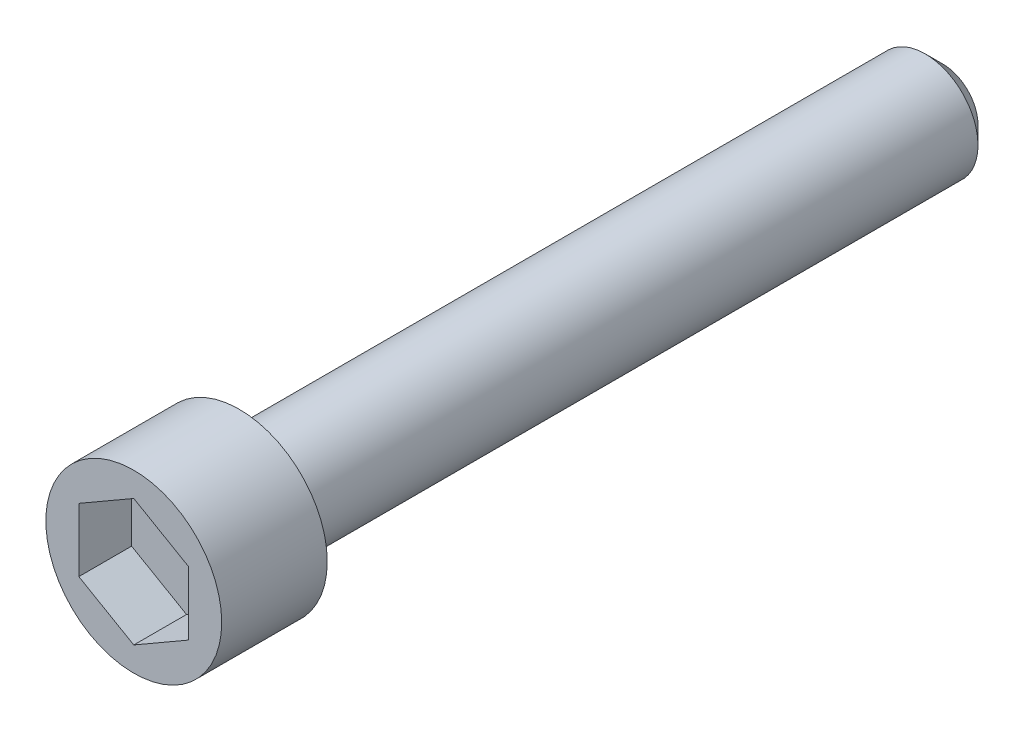
from build123d import *

# Parameters (mm, degrees)
SKETCH_1_R          = 1.5
EXTRUDE_1_DEPTH     = 20
SKETCH_2_R          = 2.5
EXTRUDE_2_DEPTH     = 3
CUT_EXTRUDE_1_DEPTH = 1.5
CHAMFER_1_SIZE      = 0.5


with BuildPart() as part:
    # 草图1 → 凸台-拉伸1 (new body)
    with BuildSketch(Plane.XY):
        Circle(SKETCH_1_R)
    extrude(amount=EXTRUDE_1_DEPTH)

    # 草图2 → 凸台-拉伸2 (add)
    with BuildSketch(Plane.XY.offset(20)):
        Circle(SKETCH_2_R)
    extrude(amount=EXTRUDE_2_DEPTH)

    # 草图3 → 切除-拉伸1 (cut)
    with BuildSketch(Plane.XY.offset(23)):
        Polygon((0, 1.803382283), (-1.56177487, 0.901691141), (-1.56177487, -0.901691141), (0, -1.803382283), (1.56177487, -0.901691141), (1.56177487, 0.901691141), align=None)
    extrude(amount=-CUT_EXTRUDE_1_DEPTH, mode=Mode.SUBTRACT)

    # 倒角1
    chamfer_1_edges = [part.edges().sort_by_distance(p)[0] for p in [
        (-1.5, 0, 0),
    ]]
    chamfer(chamfer_1_edges, length=CHAMFER_1_SIZE)


solid = part.part
